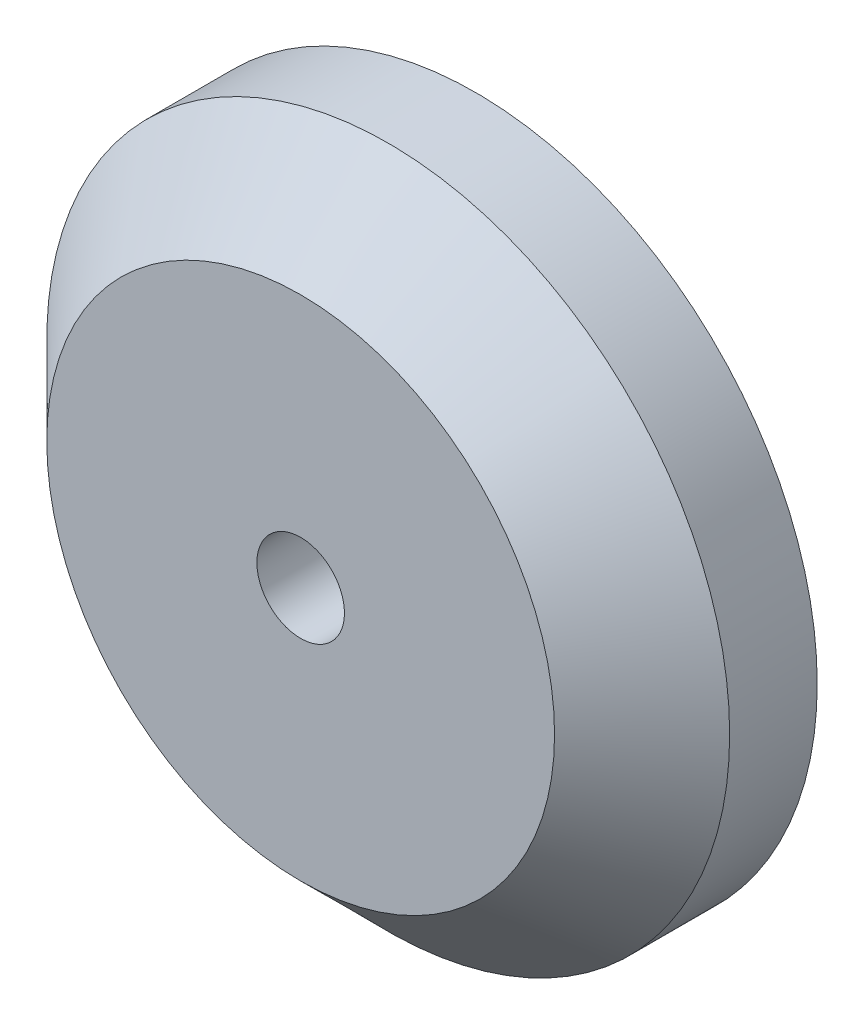
from build123d import *

# Parameters (mm, degrees)
SKETCH1_R           = 9.75
BOSS_EXTRUDE1_DEPTH = 5
SKETCH2_R           = 1.25
CUT_EXTRUDE1_DEPTH  = 5
CHAMFER1_SIZE       = 2.5
SKETCH4_R           = 2.5
CUT_EXTRUDE3_DEPTH  = 2.5


with BuildPart() as part:
    # Sketch1 → Boss-Extrude1 (new body)
    with BuildSketch(Plane.XY):
        Circle(SKETCH1_R)
    extrude(amount=BOSS_EXTRUDE1_DEPTH)

    # Sketch2 → Cut-Extrude1 (cut)
    with BuildSketch(Plane(origin=(0, 0, 0), x_dir=(-1, 0, 0), z_dir=(0, 0, -1))):
        Circle(SKETCH2_R)
    extrude(amount=-CUT_EXTRUDE1_DEPTH, mode=Mode.SUBTRACT)

    # Chamfer1
    chamfer1_edges = [part.edges().sort_by_distance(p)[0] for p in [
        (-9.75, 0, 5),
    ]]
    chamfer(chamfer1_edges, length=CHAMFER1_SIZE)

    # Sketch4 → Cut-Extrude3 (cut)
    with BuildSketch(Plane(origin=(0, 0, 0), x_dir=(-1, 0, 0), z_dir=(0, 0, -1))):
        Circle(SKETCH4_R)
    extrude(amount=-CUT_EXTRUDE3_DEPTH, mode=Mode.SUBTRACT)


solid = part.part
